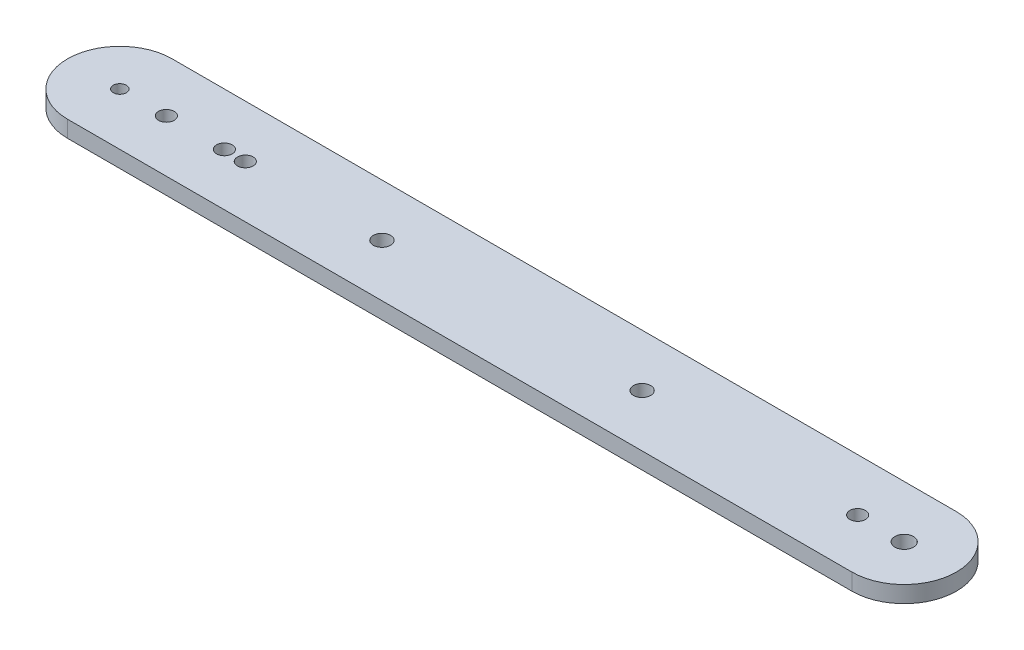
from build123d import *

# Parameters (mm, degrees)
SKETCH1_R           = 1.5
SKETCH1_R_2         = 1.775813941
SKETCH1_R_3         = 1.65
SKETCH1_R_4         = 1.25
BOSS_EXTRUDE1_DEPTH = 3.175


with BuildPart() as part:
    # Sketch1 → Boss-Extrude1 (new body)
    with BuildSketch(Plane(origin=(0, 0, 0), x_dir=(1, 0, 0), z_dir=(0, 1, 0))):
        with BuildLine():
            Line((-75, 7.5), (75, 7.5))
            ThreePointArc((75, 7.5), (85, -2.5), (75, -12.5))
            Line((75, -12.5), (-75, -12.5))
            ThreePointArc((-75, -12.5), (-85, -2.5), (-75, 7.5))
        make_face()
        with Locations(Location((-66.1, -2.5, 0), (0, 0, 270))):
            Circle(SKETCH1_R, mode=Mode.SUBTRACT)
        with Locations(Location((-55, -2.5, 0), (0, 0, 270))):
            Circle(SKETCH1_R, mode=Mode.SUBTRACT)
        with Locations(Location((-51, -2.5, 0), (0, 0, 270))):
            Circle(SKETCH1_R, mode=Mode.SUBTRACT)
        with Locations(Location((66.1, -2.5, 0), (0, 0, 270))):
            Circle(SKETCH1_R, mode=Mode.SUBTRACT)
        with Locations(Location((75, -2.5, 0), (0, 0, 270))):
            Circle(SKETCH1_R_2, mode=Mode.SUBTRACT)
        with Locations(Location((24.874685928, -2.5, 0), (0, 0, 270))):
            Circle(SKETCH1_R_3, mode=Mode.SUBTRACT)
        with Locations(Location((-24.874685928, -2.5, 0), (0, 0, 90))):
            Circle(SKETCH1_R_3, mode=Mode.SUBTRACT)
        with Locations(Location((-75, -2.5, 0), (0, 0, 270))):
            Circle(SKETCH1_R_4, mode=Mode.SUBTRACT)
    extrude(amount=BOSS_EXTRUDE1_DEPTH)


solid = part.part
